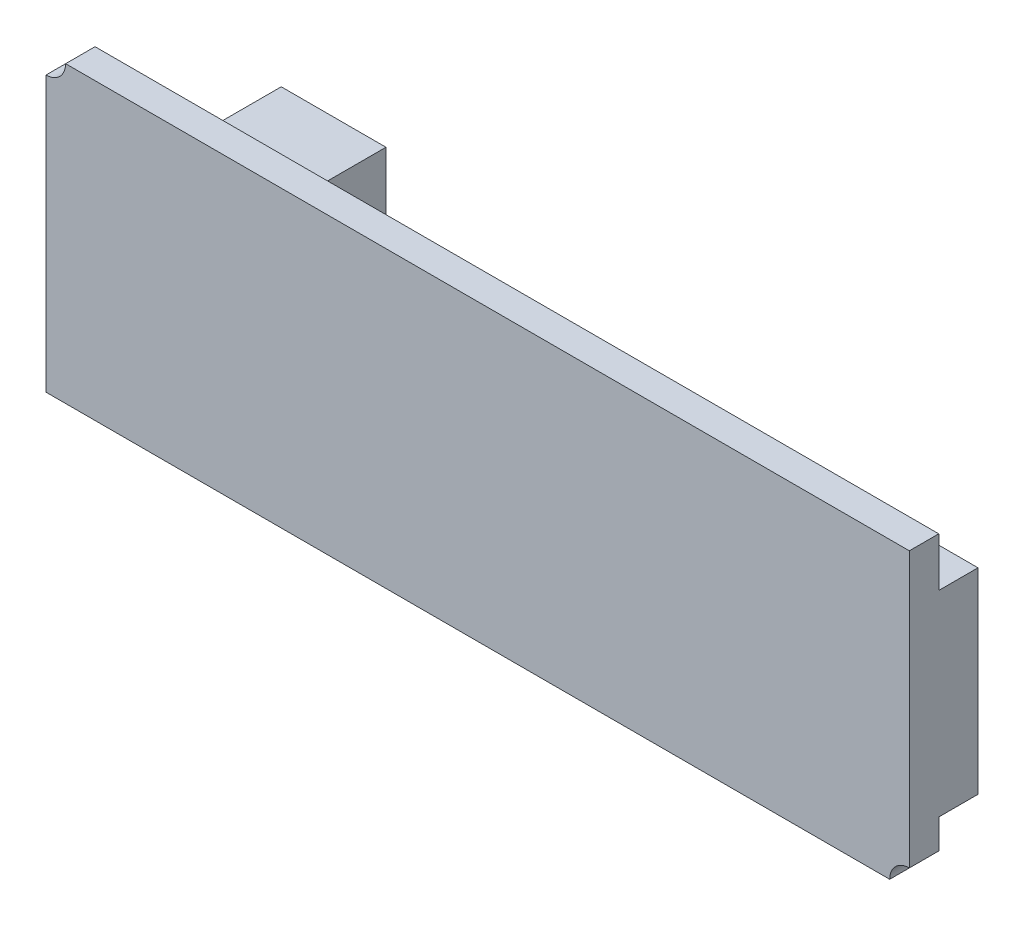
from build123d import *

# Parameters (mm, degrees)
ESQUISSE1_W         = 44
ESQUISSE1_H         = 15
BOSS_EXTRU_1_DEPTH  = 1.5
ESQUISSE2_W         = 6
ESQUISSE2_H         = 10
BOSS_EXTRU_2_DEPTH  = 2
CUT_EXTRUDE1_REACH  = 48.618
SKETCH1_R           = 1
SKETCH2_W           = 5.336665058
SKETCH2_H           = 9.146011637
BOSS_EXTRUDE1_DEPTH = 6


with BuildPart() as part:
    # Esquisse1 → Boss.-Extru.1 (new body)
    with BuildSketch(Plane.XY):
        with Locations((22, 7.5)):
            Rectangle(ESQUISSE1_W, ESQUISSE1_H)
    extrude(amount=BOSS_EXTRU_1_DEPTH)

    # Esquisse2 → Boss.-Extru.2 (add)
    with BuildSketch(Plane(origin=(0, 0, 0), x_dir=(-1, 0, 0), z_dir=(0, 0, -1))):
        with Locations((-41, 7.5)):
            Rectangle(ESQUISSE2_W, ESQUISSE2_H)
    extrude(amount=BOSS_EXTRU_2_DEPTH)

    # Sketch1 → Cut-Extrude1 (cut, up to next)
    with BuildSketch(Plane.XY.offset(1.5), mode=Mode.PRIVATE) as cut_extrude1_sk1:
        with Locations((44, 0)):
            Circle(SKETCH1_R)
    cut_extrude1_tool1 = extrude(cut_extrude1_sk1.sketch, amount=-CUT_EXTRUDE1_REACH, mode=Mode.PRIVATE) & part.part
    # Sketch1 → Cut-Extrude1 (cut, up to next)
    with BuildSketch(Plane.XY.offset(1.5), mode=Mode.PRIVATE) as cut_extrude1_sk2:
        with Locations((0, 15)):
            Circle(SKETCH1_R)
    cut_extrude1_tool2 = extrude(cut_extrude1_sk2.sketch, amount=-CUT_EXTRUDE1_REACH, mode=Mode.PRIVATE) & part.part
    add(cut_extrude1_tool1.solids().sort_by_distance((44, 0, 1.5))[0], mode=Mode.SUBTRACT)
    add(cut_extrude1_tool2.solids().sort_by_distance((0, 15, 1.5))[0], mode=Mode.SUBTRACT)

    # Sketch2 → Boss-Extrude1 (add)
    with BuildSketch(Plane(origin=(0, 0, 0), x_dir=(1, 0, 0), z_dir=(0, 0, -1))):
        with Locations((7.157544366, -7.402304661)):
            Rectangle(SKETCH2_W, SKETCH2_H)
    extrude(amount=BOSS_EXTRUDE1_DEPTH)


solid = part.part
